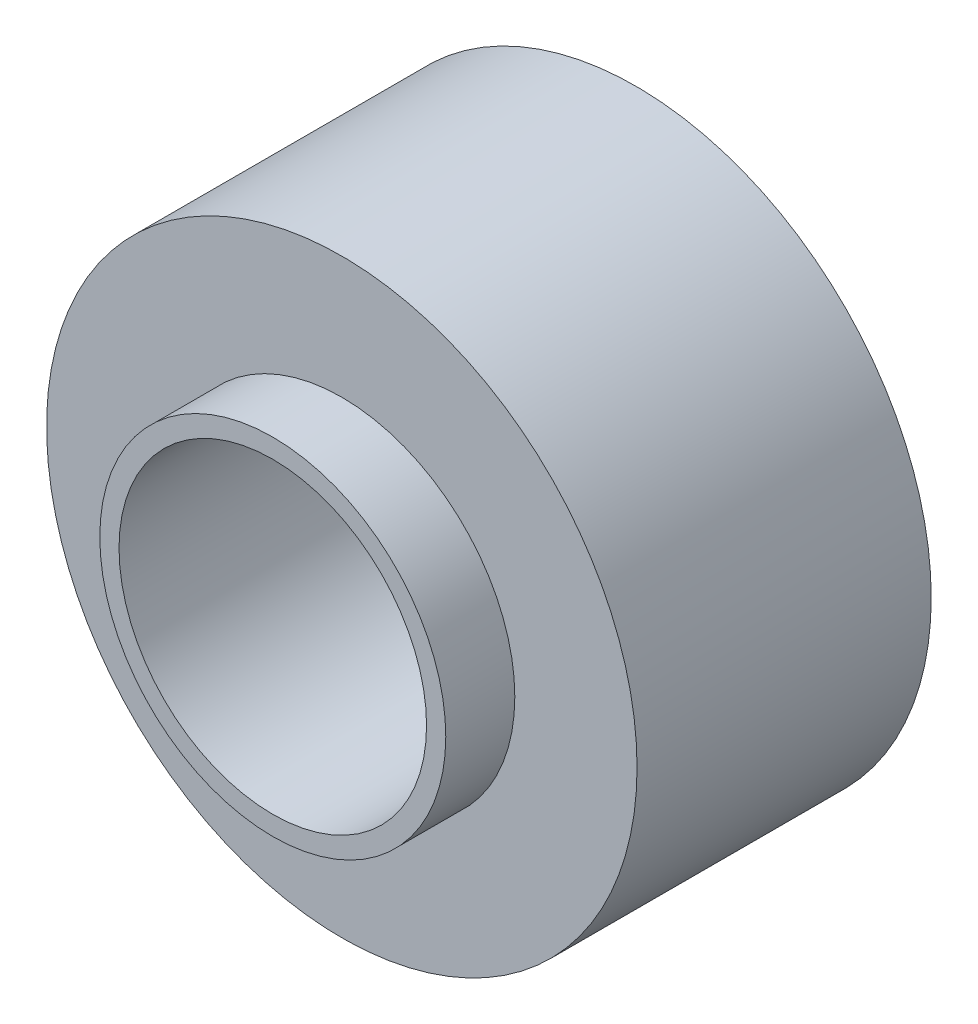
from build123d import *

# Parameters (mm, degrees)
SKETCH1_R           = 28.575
SKETCH1_R_2         = 25.4
BOSS_EXTRUDE1_DEPTH = 35.6997
SKETCH2_R           = 48.768
SKETCH2_R_2         = 28.575
BOSS_EXTRUDE2_DEPTH = 24.2951


with BuildPart() as part:
    # Sketch1 → Boss-Extrude1 (new, symmetric)
    with BuildSketch(Plane.XY):
        Circle(SKETCH1_R)
        Circle(SKETCH1_R_2, mode=Mode.SUBTRACT)
    extrude(amount=BOSS_EXTRUDE1_DEPTH, both=True)

    # Sketch2 → Boss-Extrude2 (add, symmetric)
    with BuildSketch(Plane.XY):
        Circle(SKETCH2_R)
        Circle(SKETCH2_R_2, mode=Mode.SUBTRACT)
    extrude(amount=BOSS_EXTRUDE2_DEPTH, both=True)


solid = part.part
